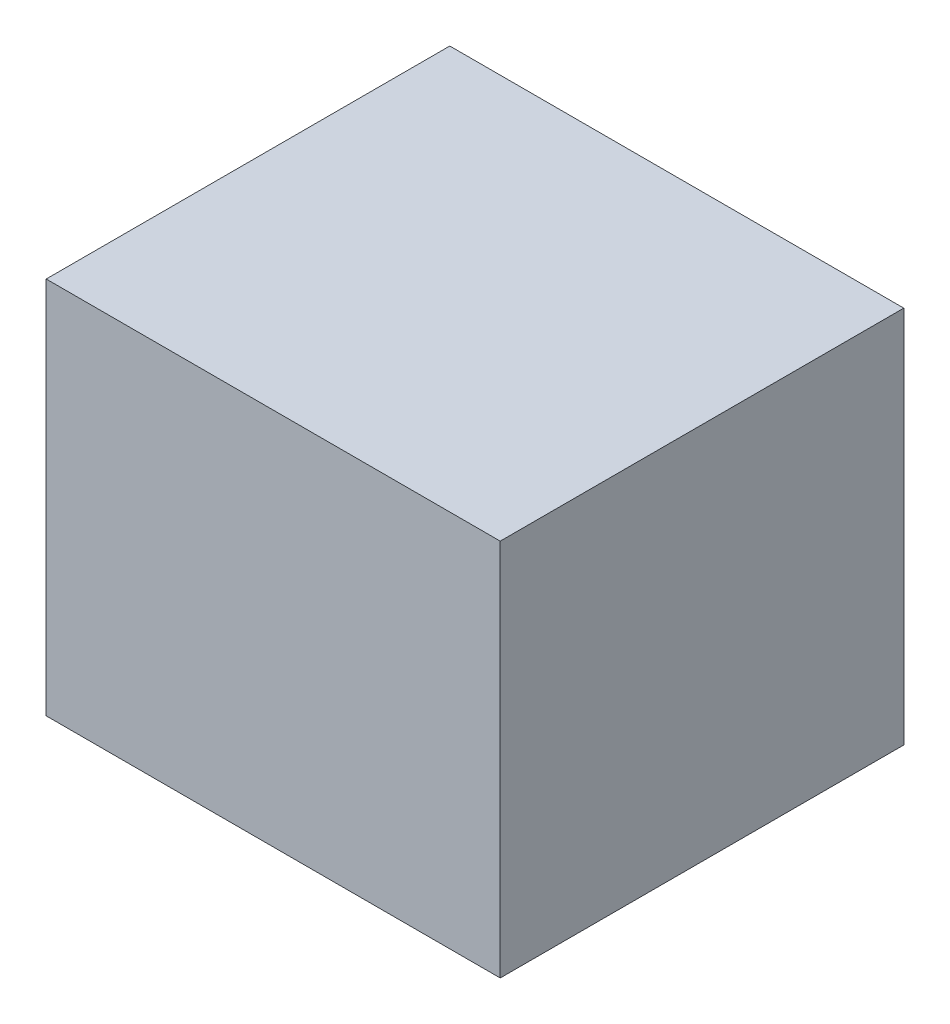
from build123d import *

# Parameters (mm, degrees)
SKETCH1_W           = 18
SKETCH1_H           = 16
BOSS_EXTRUDE2_DEPTH = 15


with BuildPart() as part:
    # Sketch1 → Boss-Extrude2 (new body)
    with BuildSketch(Plane(origin=(0, 0, 0), x_dir=(1, 0, 0), z_dir=(0, 1, 0))):
        Rectangle(SKETCH1_W, SKETCH1_H)
    extrude(amount=BOSS_EXTRUDE2_DEPTH)


solid = part.part
